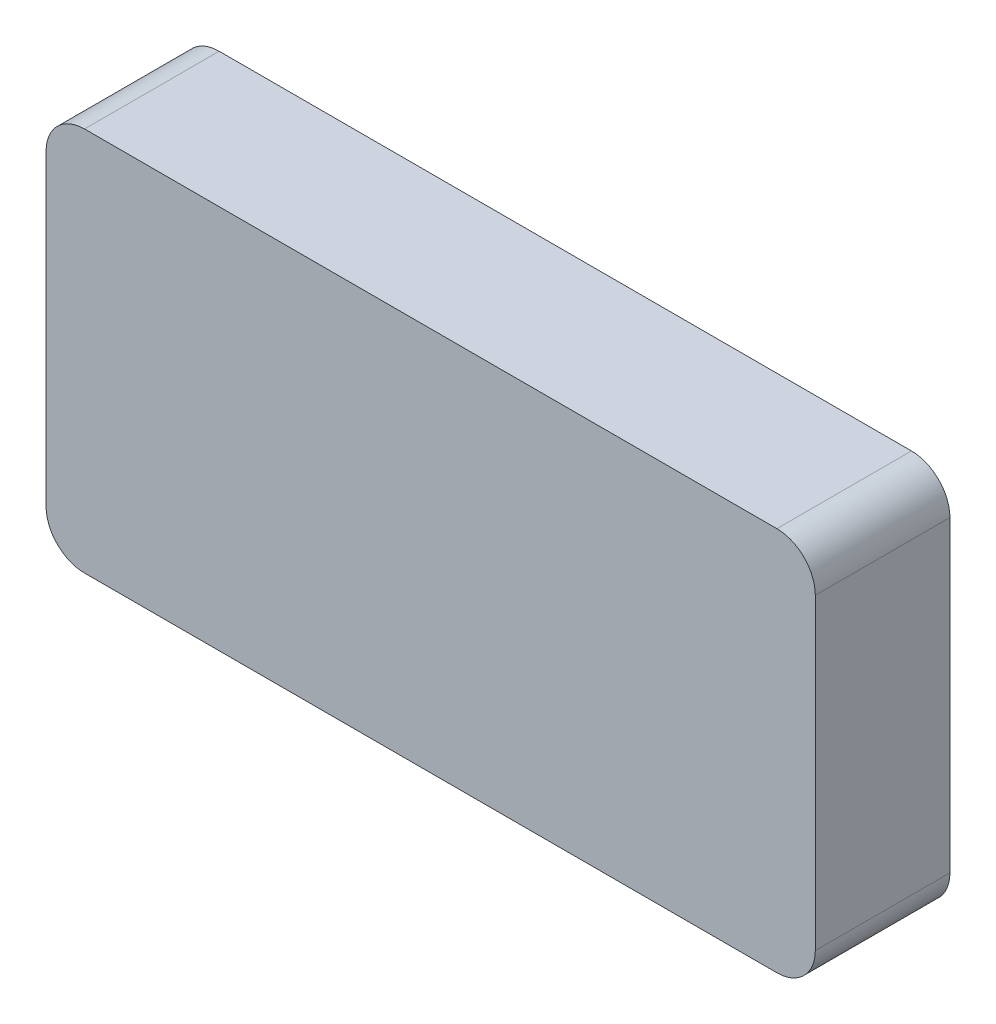
from build123d import *

# Parameters (mm, degrees)
BOSS_EXTRUDE1_DEPTH = 3.5
SKETCH2_W           = 18
SKETCH2_H           = 8
CUT_EXTRUDE1_DEPTH  = 1


with BuildPart() as part:
    # Sketch1 → Boss-Extrude1 (new body)
    with BuildSketch(Plane.XY):
        with BuildLine():
            Line((-9, 5), (9, 5))
            ThreePointArc((9, 5), (9.707106781, 4.707106781), (10, 4))
            Line((10, 4), (10, -4))
            ThreePointArc((10, -4), (9.707106781, -4.707106781), (9, -5))
            Line((9, -5), (-9, -5))
            ThreePointArc((-9, -5), (-9.707106781, -4.707106781), (-10, -4))
            Line((-10, -4), (-10, 4))
            ThreePointArc((-10, 4), (-9.707106781, 4.707106781), (-9, 5))
        make_face()
    extrude(amount=BOSS_EXTRUDE1_DEPTH)

    # Sketch2 → Cut-Extrude1 (cut)
    with BuildSketch(Plane(origin=(0, 0, 0), x_dir=(-1, 0, 0), z_dir=(0, 0, -1))):
        Rectangle(SKETCH2_W, SKETCH2_H)
    extrude(amount=-CUT_EXTRUDE1_DEPTH, mode=Mode.SUBTRACT)


solid = part.part
